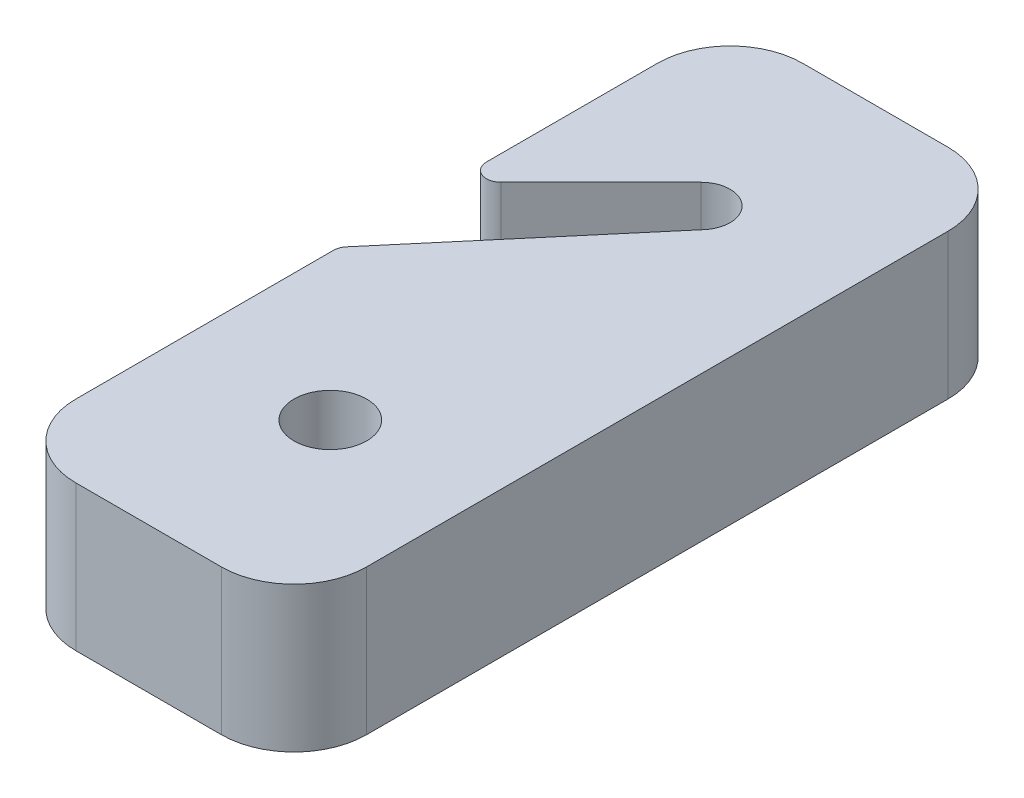
from build123d import *

# Parameters (mm, degrees)
SKETCH1_W           = 12.7
SKETCH1_H           = 31.75
SKETCH1_R           = 1.5875
BOSS_EXTRUDE2_DEPTH = 6.35
CUT_EXTRUDE2_DEPTH  = 19.238986403
FILLET2_R           = 3.175
FILLET3_R           = 0.635


with BuildPart() as part:
    # Sketch1 → Boss-Extrude2 (new body)
    with BuildSketch(Plane(origin=(0, 0, 0), x_dir=(1, 0, 0), z_dir=(0, 1, 0))):
        Rectangle(SKETCH1_W, SKETCH1_H)
        with Locations((0, -7.9375)):
            Circle(SKETCH1_R, mode=Mode.SUBTRACT)
    extrude(amount=BOSS_EXTRUDE2_DEPTH)

    # Sketch1<5> → Cut-Extrude2 (cut, through all)
    with BuildSketch(Plane(origin=(0, 0, 0), x_dir=(1, 0, 0), z_dir=(0, 1, 0))):
        with BuildLine():
            Line((-6.35, 3.701051224), (-6.35, -1.213547665))
            Line((-6.35, -1.213547665), (0.969401523, 7.434536298))
            ThreePointArc((0.969401523, 7.434536298), (0.859985471, 9.189518587), (-0.898025612, 9.153025612))
            Line((-0.898025612, 9.153025612), (-6.35, 3.701051224))
        make_face()
    extrude(amount=CUT_EXTRUDE2_DEPTH, mode=Mode.SUBTRACT)

    # Fillet2
    fillet2_edges = [part.edges().sort_by_distance(p)[0] for p in [
        (-6.35, 3.175, -15.875),
        (6.35, 3.175, -15.875),
        (6.35, 3.175, 15.875),
        (-6.35, 3.175, 15.875),
    ]]
    fillet(fillet2_edges, radius=FILLET2_R)

    # Fillet3
    fillet3_edges = [part.edges().sort_by_distance(p)[0] for p in [
        (-6.35, 3.175, 1.213547665),
        (-6.35, 3.175, -3.701051224),
    ]]
    fillet(fillet3_edges, radius=FILLET3_R)


solid = part.part
